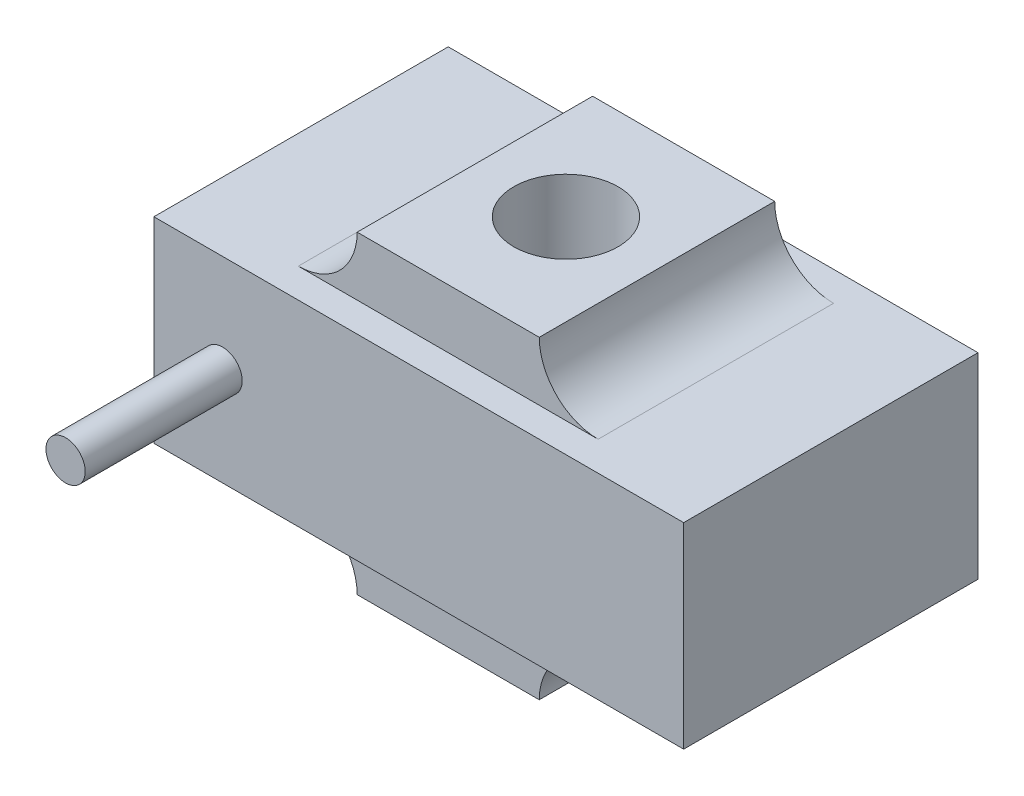
from build123d import *

# Parameters (mm, degrees)
SKETCH1_W                   = 42.8625
SKETCH1_H                   = 15.875
EXTRUDE1_DEPTH              = 11.90625
EXTRUDE2_DEPTH              = 9.525
F_3_8_24_TAPPED_HOLE1_D     = 8.4328
F_3_8_24_TAPPED_HOLE1_DEPTH = 9.525
F_3_8_24_TAPPED_HOLE1_TIP   = 2.533468714
F_3_8_24_TAPPED_HOLE2_D     = 8.4328
F_3_8_24_TAPPED_HOLE2_DEPTH = 9.525
F_3_8_24_TAPPED_HOLE2_TIP   = 2.533468714
SKETCH7_R                   = 1.5875
EXTRUDE3_DEPTH              = 12.7


with BuildPart() as part:
    # Sketch1 → Extrude1 (new, symmetric)
    with BuildSketch(Plane.XY):
        Rectangle(SKETCH1_W, SKETCH1_H)
    extrude(amount=EXTRUDE1_DEPTH, both=True)

    # Sketch2 → Extrude2 (add, symmetric)
    with BuildSketch(Plane.XY):
        with BuildLine():
            Line((-7.366, 12.7), (7.366, 12.7))
            ThreePointArc((7.366, 12.7), (8.760903955, 9.332403955), (12.1285, 7.9375))
            Line((12.1285, 7.9375), (-12.1285, 7.9375))
            ThreePointArc((-12.1285, 7.9375), (-8.760903955, 9.332403955), (-7.366, 12.7))
        make_face()
        with BuildLine():
            Line((-7.366, -12.7), (7.366, -12.7))
            ThreePointArc((7.366, -12.7), (8.760903955, -9.332403955), (12.1285, -7.9375))
            Line((12.1285, -7.9375), (-12.1285, -7.9375))
            ThreePointArc((-12.1285, -7.9375), (-8.760903955, -9.332403955), (-7.366, -12.7))
        make_face()
    extrude(amount=EXTRUDE2_DEPTH, both=True)

    # 3/8-24 Tapped Hole1
    with Locations(Plane(origin=(0, 12.7, 0), x_dir=(-1, 0, 0), z_dir=(0, 1, 0))):
        with Locations((0, 0)):
            Hole(F_3_8_24_TAPPED_HOLE1_D / 2, depth=F_3_8_24_TAPPED_HOLE1_DEPTH)
            with Locations((0, 0, -(F_3_8_24_TAPPED_HOLE1_DEPTH + F_3_8_24_TAPPED_HOLE1_TIP / 2))):  # 118° drill point
                Cone(0, F_3_8_24_TAPPED_HOLE1_D / 2, F_3_8_24_TAPPED_HOLE1_TIP, mode=Mode.SUBTRACT)

    # 3/8-24 Tapped Hole2
    with Locations(Plane.XZ.offset(12.7)):
        with Locations((0, 0)):
            Hole(F_3_8_24_TAPPED_HOLE2_D / 2, depth=F_3_8_24_TAPPED_HOLE2_DEPTH)
            with Locations((0, 0, -(F_3_8_24_TAPPED_HOLE2_DEPTH + F_3_8_24_TAPPED_HOLE2_TIP / 2))):  # 118° drill point
                Cone(0, F_3_8_24_TAPPED_HOLE2_D / 2, F_3_8_24_TAPPED_HOLE2_TIP, mode=Mode.SUBTRACT)

    # Sketch7 → Extrude3 (add)
    with BuildSketch(Plane.XY.offset(11.90625)):
        with Locations((-15.875, 0)):
            Circle(SKETCH7_R)
    extrude(amount=EXTRUDE3_DEPTH)


solid = part.part
